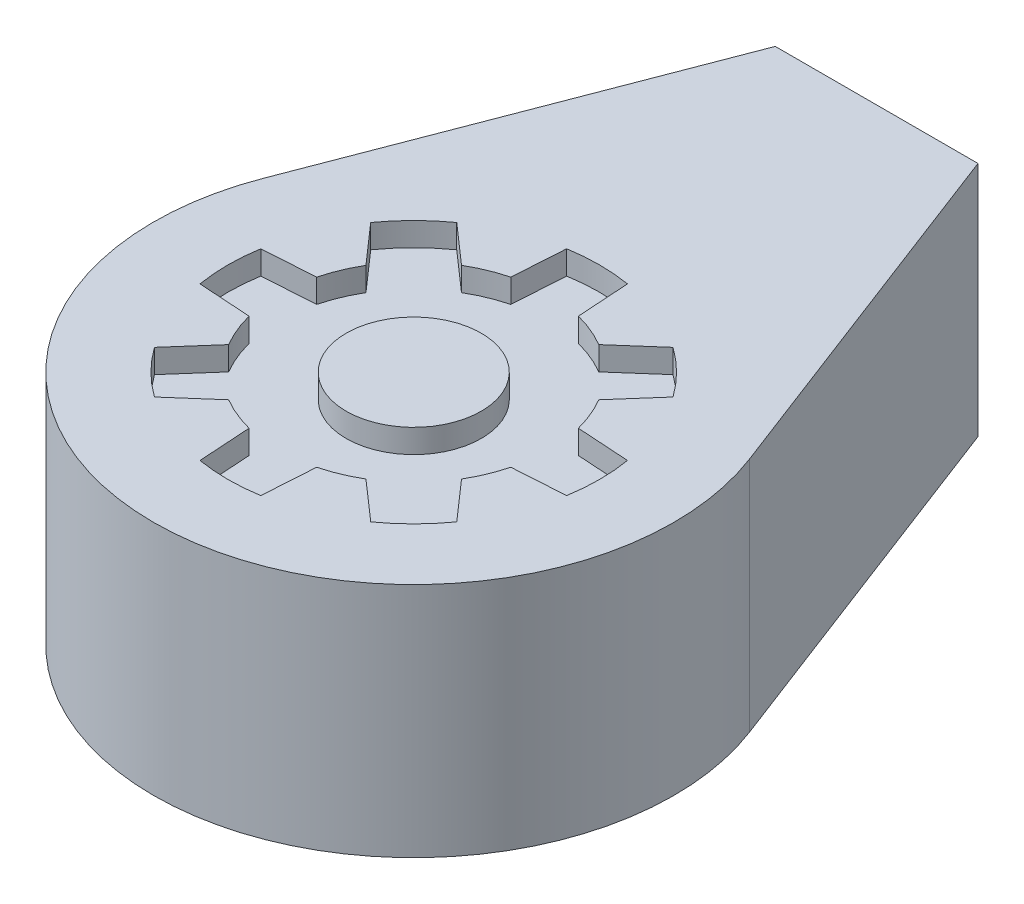
from build123d import *

# Parameters (mm, degrees)
BOSS_EXTRUDE1_DEPTH = 6
BOSS_EXTRUDE2_DEPTH = 1
BOSS_EXTRUDE3_START = 6
BOSS_EXTRUDE3_DEPTH = 6
SKETCH4_R           = 4
CUT_EXTRUDE1_DEPTH  = 0.7
SKETCH5_R           = 2
BOSS_EXTRUDE4_DEPTH = 0.7


with BuildPart() as part:
    # Sketch1 → Boss-Extrude1 (new body)
    with BuildSketch(Plane(origin=(0, 0, 0), x_dir=(1, 0, 0), z_dir=(0, 1, 0))):
        with BuildLine():
            ThreePointArc((-2.5, 7.282856582), (-7.7, 0), (-2.5, -7.282856582))
            Line((-2.5, -7.282856582), (-2.5, -6.216108107))
            ThreePointArc((-2.5, -6.216108107), (-6.7, 0), (-2.5, 6.216108107))
            Line((-2.5, 6.216108107), (-2.5, 7.282856582))
        make_face()
        with BuildLine():
            Line((-2.5, -6.216108107), (-2.5, -7.282856582))
            ThreePointArc((-2.5, -7.282856582), (0, -7.7), (2.5, -7.282856582))
            Line((2.5, -7.282856582), (2.5, -6.216108107))
            ThreePointArc((2.5, -6.216108107), (0, -6.7), (-2.5, -6.216108107))
        make_face()
        with BuildLine():
            Line((2.5, -6.216108107), (2.5, -7.282856582))
            ThreePointArc((2.5, -7.282856582), (6.266578014, -4.474371464), (7.7, 0))
            ThreePointArc((7.7, 0), (6.266578014, 4.474371464), (2.5, 7.282856582))
            Line((2.5, 7.282856582), (2.5, 6.216108107))
            ThreePointArc((2.5, 6.216108107), (5.551576353, 3.750999867), (6.7, 0))
            ThreePointArc((6.7, 0), (5.551576353, -3.750999867), (2.5, -6.216108107))
        make_face()
    extrude(amount=BOSS_EXTRUDE1_DEPTH)

    # Sketch2 → Boss-Extrude2 (add)
    with BuildSketch(Plane(origin=(0, 6, 0), x_dir=(1, 0, 0), z_dir=(0, 1, 0))):
        with BuildLine():
            Line((3, 13.7), (-3, 13.7))
            Line((-3, 13.7), (-7.191011254, 2.753063229))
            ThreePointArc((-7.191011254, 2.753063229), (-5.348708418, 5.539071968), (-2.5, 7.282856582))
            ThreePointArc((-2.5, 7.282856582), (0, 7.7), (2.5, 7.282856582))
            ThreePointArc((2.5, 7.282856582), (5.348708418, 5.539071968), (7.191011254, 2.753063229))
            Line((7.191011254, 2.753063229), (3, 13.7))
        make_face()
        with BuildLine():
            ThreePointArc((2.5, 6.216108107), (0, -6.7), (-2.5, 6.216108107))
            Line((-2.5, 6.216108107), (-2.5, 7.282856582))
            ThreePointArc((-2.5, 7.282856582), (0, -7.7), (2.5, 7.282856582))
            Line((2.5, 7.282856582), (2.5, 6.216108107))
        make_face()
        with BuildLine():
            ThreePointArc((-2.5, 7.282856582), (-5.348708418, 5.539071968), (-7.191011254, 2.753063229))
            ThreePointArc((-7.191011254, 2.753063229), (-1.399859519, -7.571683652), (7.7, 0))
            ThreePointArc((7.7, 0), (7.571683652, 1.399859519), (7.191011254, 2.753063229))
            ThreePointArc((7.191011254, 2.753063229), (5.348708418, 5.539071968), (2.5, 7.282856582))
            Line((2.5, 7.282856582), (2.5, 6.216108107))
            ThreePointArc((2.5, 6.216108107), (0, -6.7), (-2.5, 6.216108107))
            Line((-2.5, 6.216108107), (-2.5, 7.282856582))
        make_face()
        with BuildLine():
            ThreePointArc((2.5, 7.282856582), (0, 7.7), (-2.5, 7.282856582))
            Line((-2.5, 7.282856582), (-2.5, 6.216108107))
            ThreePointArc((-2.5, 6.216108107), (0, -6.7), (2.5, 6.216108107))
            Line((2.5, 6.216108107), (2.5, 7.282856582))
        make_face()
    extrude(amount=BOSS_EXTRUDE2_DEPTH)

    # Sketch3 → Boss-Extrude3 (add)
    with BuildSketch(Plane.XZ.offset(-6).offset(BOSS_EXTRUDE3_START)):
        with BuildLine():
            Line((-7.191011254, -2.753063229), (-3, -13.7))
            Line((-3, -13.7), (-1.929218753, -13.7))
            Line((-1.929218753, -13.7), (-2.5, -7.282856582))
            ThreePointArc((-2.5, -7.282856582), (-5.348708418, -5.539071968), (-7.191011254, -2.753063229))
        make_face()
        with BuildLine():
            Line((2.5, -7.282856582), (1.929218753, -13.7))
            Line((1.929218753, -13.7), (3, -13.7))
            Line((3, -13.7), (7.191011254, -2.753063229))
            ThreePointArc((7.191011254, -2.753063229), (5.348708418, -5.539071968), (2.5, -7.282856582))
        make_face()
    extrude(amount=-BOSS_EXTRUDE3_DEPTH)

    # Sketch4 → Cut-Extrude1 (cut)
    with BuildSketch(Plane(origin=(0, 7, 0), x_dir=(1, 0, 0), z_dir=(0, 1, 0))):
        Circle(SKETCH4_R)
        with BuildLine():
            Line((-2.031506006, 3.445719569), (-3.200269116, 4.473061322))
            ThreePointArc((-3.200269116, 4.473061322), (-3.889087297, 3.889087297), (-4.473061322, 3.200269116))
            Line((-4.473061322, 3.200269116), (-3.445719569, 2.031506006))
            ThreePointArc((-3.445719569, 2.031506006), (-2.828427125, 2.828427125), (-2.031506006, 3.445719569))
        make_face()
        with BuildLine():
            Line((-3.872983346, 1), (-5.425863987, 0.9))
            ThreePointArc((-5.425863987, 0.9), (-5.5, 0), (-5.425863987, -0.9))
            Line((-5.425863987, -0.9), (-3.872983346, -1))
            ThreePointArc((-3.872983346, -1), (-4, 0), (-3.872983346, 1))
        make_face()
        with BuildLine():
            Line((-3.445719569, -2.031506006), (-4.473061322, -3.200269116))
            ThreePointArc((-4.473061322, -3.200269116), (-3.889087297, -3.889087297), (-3.200269116, -4.473061322))
            Line((-3.200269116, -4.473061322), (-2.031506006, -3.445719569))
            ThreePointArc((-2.031506006, -3.445719569), (-2.828427125, -2.828427125), (-3.445719569, -2.031506006))
        make_face()
        with BuildLine():
            Line((-1, -3.872983346), (-0.9, -5.425863987))
            ThreePointArc((-0.9, -5.425863987), (0, -5.5), (0.9, -5.425863987))
            Line((0.9, -5.425863987), (1, -3.872983346))
            ThreePointArc((1, -3.872983346), (0, -4), (-1, -3.872983346))
        make_face()
        with BuildLine():
            ThreePointArc((3.200269116, -4.473061322), (3.889087297, -3.889087297), (4.473061322, -3.200269116))
            Line((4.473061322, -3.200269116), (3.445719569, -2.031506006))
            ThreePointArc((3.445719569, -2.031506006), (2.828427125, -2.828427125), (2.031506006, -3.445719569))
            Line((2.031506006, -3.445719569), (3.200269116, -4.473061322))
        make_face()
        with BuildLine():
            ThreePointArc((5.5, 0), (5.481434663, 0.451524127), (5.425863987, 0.9))
            Line((5.425863987, 0.9), (3.872983346, 1))
            ThreePointArc((3.872983346, 1), (3.968118785, 0.50401717), (4, 0))
            ThreePointArc((4, 0), (3.968118785, -0.50401717), (3.872983346, -1))
            Line((3.872983346, -1), (5.425863987, -0.9))
            ThreePointArc((5.425863987, -0.9), (5.481434663, -0.451524127), (5.5, 0))
        make_face()
        with BuildLine():
            ThreePointArc((4.473061322, 3.200269116), (3.889087297, 3.889087297), (3.200269116, 4.473061322))
            Line((3.200269116, 4.473061322), (2.031506006, 3.445719569))
            ThreePointArc((2.031506006, 3.445719569), (2.828427125, 2.828427125), (3.445719569, 2.031506006))
            Line((3.445719569, 2.031506006), (4.473061322, 3.200269116))
        make_face()
        with BuildLine():
            ThreePointArc((0.9, 5.425863987), (0, 5.5), (-0.9, 5.425863987))
            Line((-0.9, 5.425863987), (-1, 3.872983346))
            ThreePointArc((-1, 3.872983346), (0, 4), (1, 3.872983346))
            Line((1, 3.872983346), (0.9, 5.425863987))
        make_face()
    extrude(amount=-CUT_EXTRUDE1_DEPTH, mode=Mode.SUBTRACT)

    # Sketch5 → Boss-Extrude4 (add)
    with BuildSketch(Plane(origin=(0, 6.3, 0), x_dir=(1, 0, 0), z_dir=(0, 1, 0))):
        with Locations(Location((0, 0, 0), (0, 0, 270))):
            Circle(SKETCH5_R)
    extrude(amount=BOSS_EXTRUDE4_DEPTH)


solid = part.part
